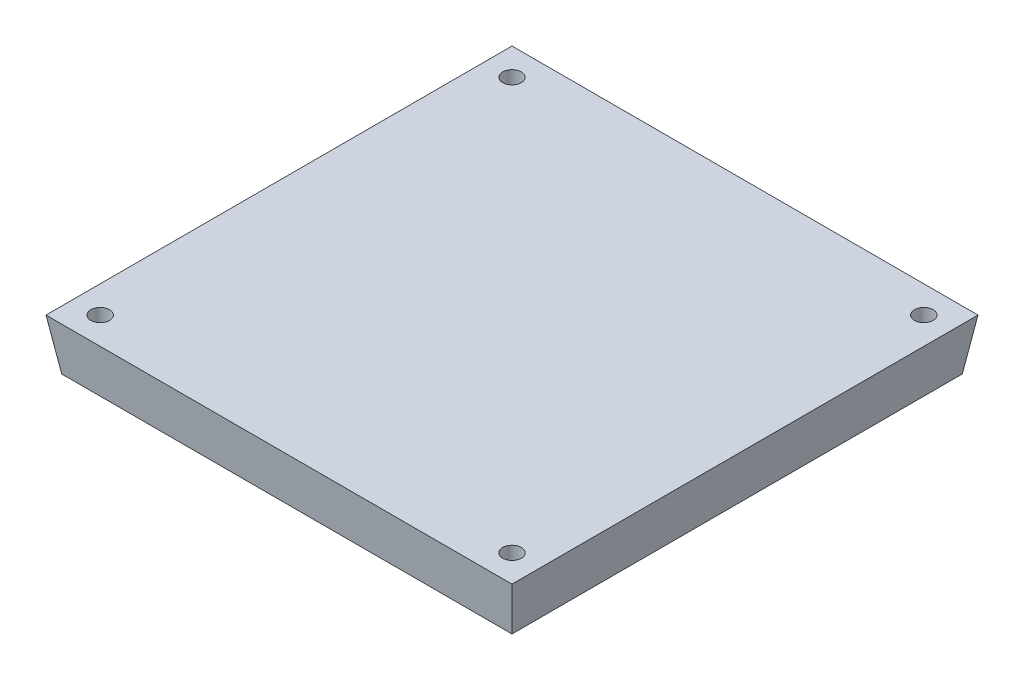
from build123d import *

# Parameters (mm, degrees)
SKETCH1_W           = 72.3
SKETCH1_H           = 72.3
BOSS_EXTRUDE1_DEPTH = 8.2
BOSS_EXTRUDE1_DRAFT = -8.77
SKETCH2_R           = 1.5
CUT_EXTRUDE1_DEPTH  = 10


with BuildPart() as part:
    # Sketch1 → Boss-Extrude1 (with draft: the straight prism first)
    with BuildSketch(Plane(origin=(0, 0, 0), x_dir=(1, 0, 0), z_dir=(0, 1, 0))):
        Rectangle(SKETCH1_W, SKETCH1_H)
    extrude(amount=BOSS_EXTRUDE1_DEPTH)
    # Boss-Extrude1: the draft: its side faces are tilted about the plane it starts from
    boss_extrude1_sides = [part.faces().sort_by_distance(p)[0] for p in [
        (-36.15, 4.1, 0),
        (0, 4.1, 36.15),
        (36.15, 4.1, 0),
        (0, 4.1, -36.15),
    ]]
    draft(boss_extrude1_sides, Plane(origin=(0, 0, 0), x_dir=(1, 0, 0), z_dir=(0, 1, 0)), BOSS_EXTRUDE1_DRAFT)

    # Sketch2 → Cut-Extrude1 (cut)
    with BuildSketch(Plane(origin=(0, 8.2, 0), x_dir=(1, 0, 0), z_dir=(0, 1, 0))):
        with Locations(Location((-33.066601018, 33.066601018, 0), (0, 0, 270))):
            Circle(SKETCH2_R)
        with Locations(Location((33.066601018, 33.066601018, 0), (0, 0, 270))):
            Circle(SKETCH2_R)
        with Locations(Location((33.066601018, -33.066601018, 0), (0, 0, 270))):
            Circle(SKETCH2_R)
        with Locations(Location((-33.066601018, -33.066601018, 0), (0, 0, 270))):
            Circle(SKETCH2_R)
    extrude(amount=-CUT_EXTRUDE1_DEPTH, mode=Mode.SUBTRACT)


solid = part.part
